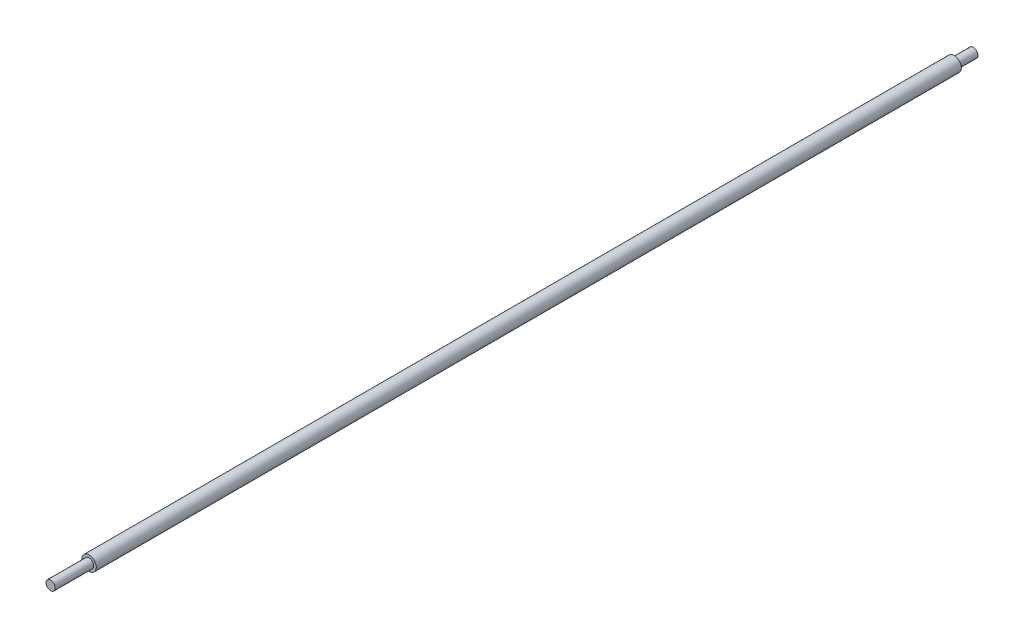
from build123d import *

# Parameters (mm, degrees)
SKETCH1_R           = 4.7625
BOSS_EXTRUDE1_DEPTH = 609.6
CUT_EXTRUDE1_START  = -25.4
SKETCH2_R           = 4.7625
SKETCH2_R_2         = 3.0607
CUT_EXTRUDE1_DEPTH  = 25.4
SKETCH3_R           = 4.7625
SKETCH3_R_2         = 3.0607
CUT_EXTRUDE3_DEPTH  = 12.7


with BuildPart() as part:
    # Sketch1 → Boss-Extrude1 (new body)
    with BuildSketch(Plane.XY):
        with Locations(Location((0, 0, 0), (0, 0, 180))):
            Circle(SKETCH1_R)
    extrude(amount=BOSS_EXTRUDE1_DEPTH)

    # Sketch2 → Cut-Extrude1 (cut)
    with BuildSketch(Plane.XY.offset(609.6).offset(CUT_EXTRUDE1_START)):
        with Locations(Location((0, 0, 0), (0, 0, 180))):
            Circle(SKETCH2_R)
        Circle(SKETCH2_R_2, mode=Mode.SUBTRACT)
    extrude(amount=CUT_EXTRUDE1_DEPTH, mode=Mode.SUBTRACT)

    # Sketch3 → Cut-Extrude3 (cut)
    with BuildSketch(Plane(origin=(0, 0, 0), x_dir=(-1, 0, 0), z_dir=(0, 0, -1))):
        Circle(SKETCH3_R)
        with Locations(Location((0, 0, 0), (0, 0, 180))):
            Circle(SKETCH3_R_2, mode=Mode.SUBTRACT)
    extrude(amount=-CUT_EXTRUDE3_DEPTH, mode=Mode.SUBTRACT)


solid = part.part
